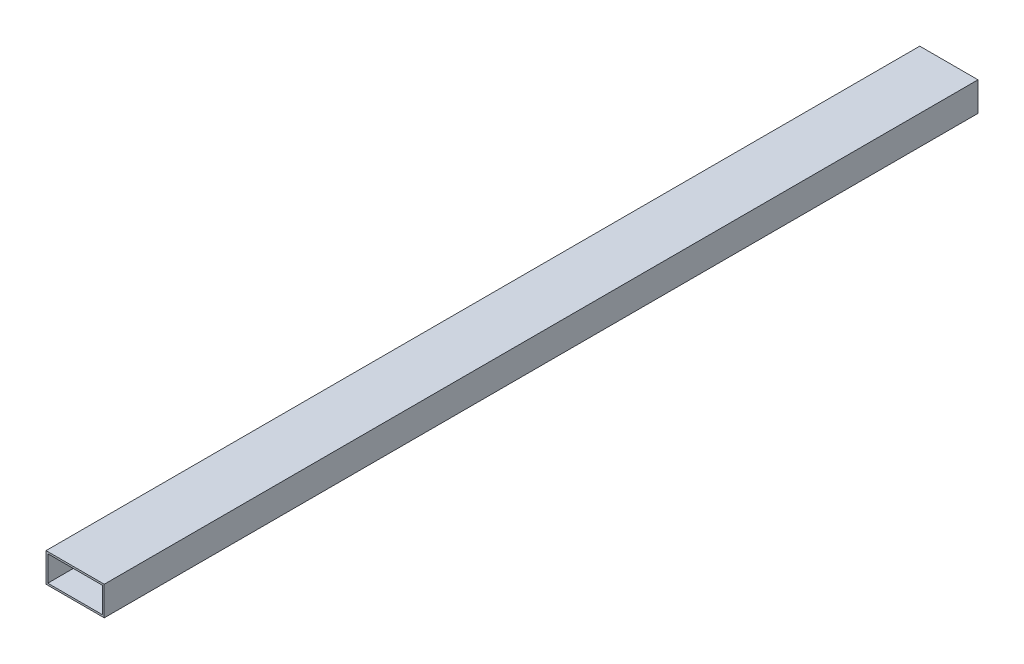
from build123d import *

# Parameters (mm, degrees)
SKETCH1_W           = 50.8
SKETCH1_H           = 25.4
SKETCH1_W_2         = 47.6504
SKETCH1_H_2         = 22.2504
EXTRUDE_THIN1_DEPTH = 762


with BuildPart() as part:
    # Sketch1 → Extrude-Thin1 (new body)
    with BuildSketch(Plane.XY):
        with Locations((-21.477220077, 5.933204633)):
            Rectangle(SKETCH1_W, SKETCH1_H)
        with Locations((-21.477220077, 5.933204633)):
            Rectangle(SKETCH1_W_2, SKETCH1_H_2, mode=Mode.SUBTRACT)
    extrude(amount=EXTRUDE_THIN1_DEPTH)


solid = part.part
